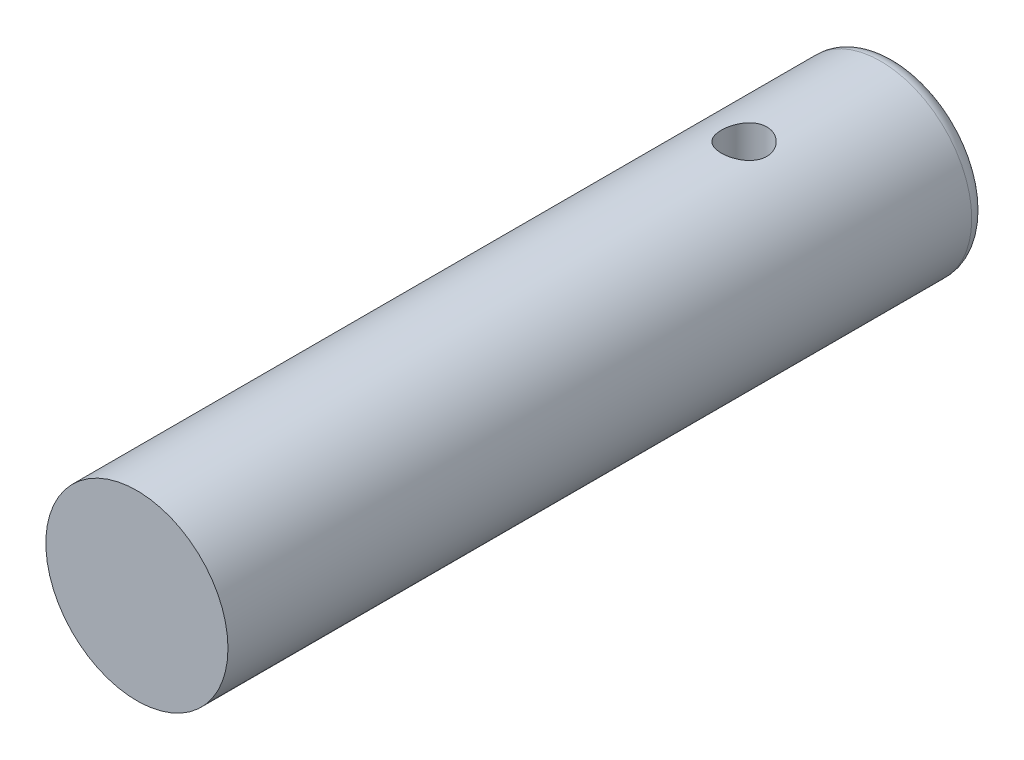
from build123d import *

# Parameters (mm, degrees)
SKETCH2_R               = 3
BOSS_EXTRUDE1_DEPTH     = 25
CUT_EXTRUDE1_DEPTH      = 26.357444666
CUT_EXTRUDE1_DEPTH_BACK = 26.357444666
SKETCH3_R               = 0.75
FILLET1_R               = 0.5


with BuildPart() as part:
    # Sketch2 → Boss-Extrude1 (new body)
    with BuildSketch(Plane.XY):
        Circle(SKETCH2_R)
    extrude(amount=BOSS_EXTRUDE1_DEPTH)

    # Sketch3 → Cut-Extrude1 (cut, two sides: drawn at the far end of the back side and taken through both)
    with BuildSketch(Plane(origin=(0, 0, 0), x_dir=(1, 0, 0), z_dir=(0, 1, 0)).offset(-CUT_EXTRUDE1_DEPTH_BACK)):
        with Locations(Location((0, -5, 0), (0, 0, 270))):
            Circle(SKETCH3_R)
    extrude(amount=CUT_EXTRUDE1_DEPTH + CUT_EXTRUDE1_DEPTH_BACK, mode=Mode.SUBTRACT)

    # Fillet1
    fillet1_edges = [part.edges().sort_by_distance(p)[0] for p in [
        (-3, 0, 0),
    ]]
    fillet(fillet1_edges, radius=FILLET1_R)


solid = part.part
